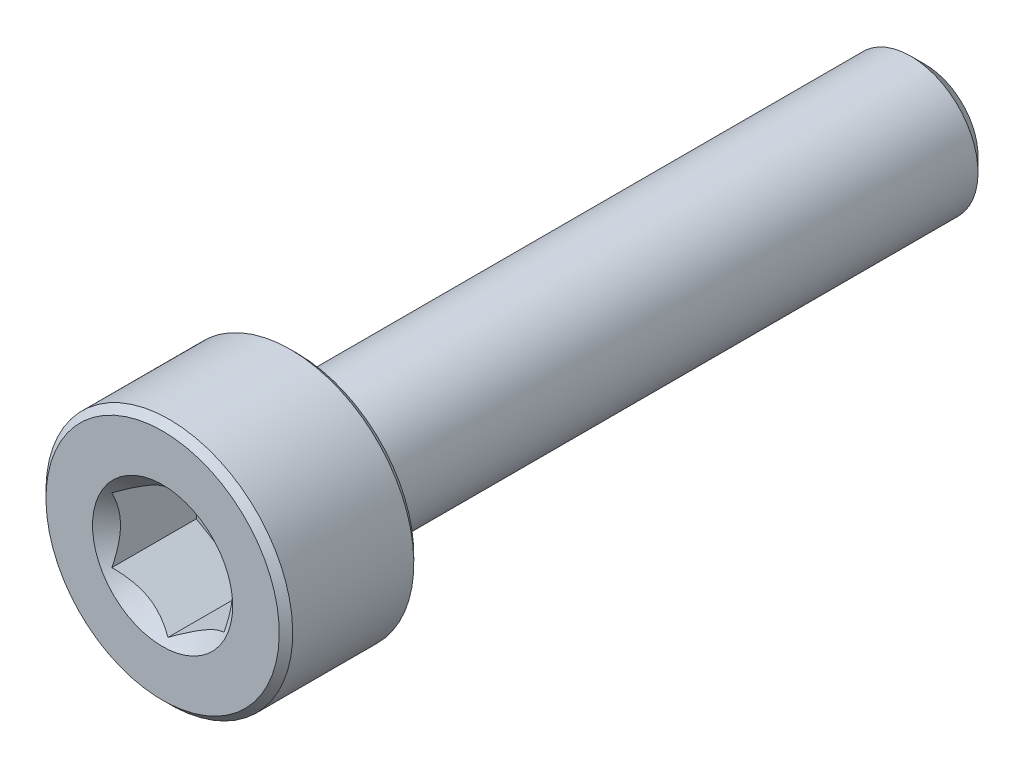
from build123d import *

# Parameters (mm, degrees)
CUT_EXTRUDE1_DEPTH = 2
SKETCH4_R          = 1.5625
CUT_EXTRUDE2_DEPTH = 1.5
CUT_EXTRUDE2_DRAFT = -45


with BuildPart() as part:
    # Sketch2 → Revolve1 (revolve)
    with BuildSketch(Plane(origin=(0, 0, 0), x_dir=(0, 0, -1), z_dir=(1, 0, 0))):
        with BuildLine():
            Line((-8.5, 0), (-8.5, 2.6))
            Line((-8.5, 2.6), (-8.35, 2.75))
            Line((-8.35, 2.75), (-5.65, 2.75))
            Line((-5.65, 2.75), (-5.5, 2.6))
            Line((-5.5, 2.6), (-5.5, 1.65))
            ThreePointArc((-5.5, 1.65), (-5.456066017, 1.543933983), (-5.35, 1.5))
            Line((-5.35, 1.5), (8.175240474, 1.5))
            Line((8.175240474, 1.5), (8.5, 1.175240474))
            Line((8.5, 1.175240474), (8.5, 0))
            Line((8.5, 0), (-8.5, 0))
        make_face()
    revolve(axis=Axis((0, 0, -8.5), (0, 0, 1)))

    # Sketch3 → Cut-Extrude1 (cut)
    with BuildSketch(Plane.XY.offset(8.5)):
        Polygon((1.25, -0.721687836), (1.25, 0.721687836), (0, 1.443375673), (-1.25, 0.721687836), (-1.25, -0.721687836), (0, -1.443375673), align=None)
    extrude(amount=-CUT_EXTRUDE1_DEPTH, mode=Mode.SUBTRACT)


with BuildPart() as cut_extrude2_tool:
    # Sketch4 → Cut-Extrude2 (with draft: the straight prism first)
    with BuildSketch(Plane.XY.offset(8.5)):
        Circle(SKETCH4_R)
    extrude(amount=-CUT_EXTRUDE2_DEPTH)
    # Cut-Extrude2: the draft: its side faces are tilted about the plane it starts from
    cut_extrude2_sides = [cut_extrude2_tool.faces().sort_by_distance(p)[0] for p in [
        (-1.5625, 0, 7.75),
    ]]
    draft(cut_extrude2_sides, Plane.XY.offset(8.5), CUT_EXTRUDE2_DRAFT)


with BuildPart() as part_1:
    add(part.part)

    # Cut-Extrude2: cut by cut_extrude2_tool
    add(cut_extrude2_tool.part, mode=Mode.SUBTRACT)


solid = part_1.part
